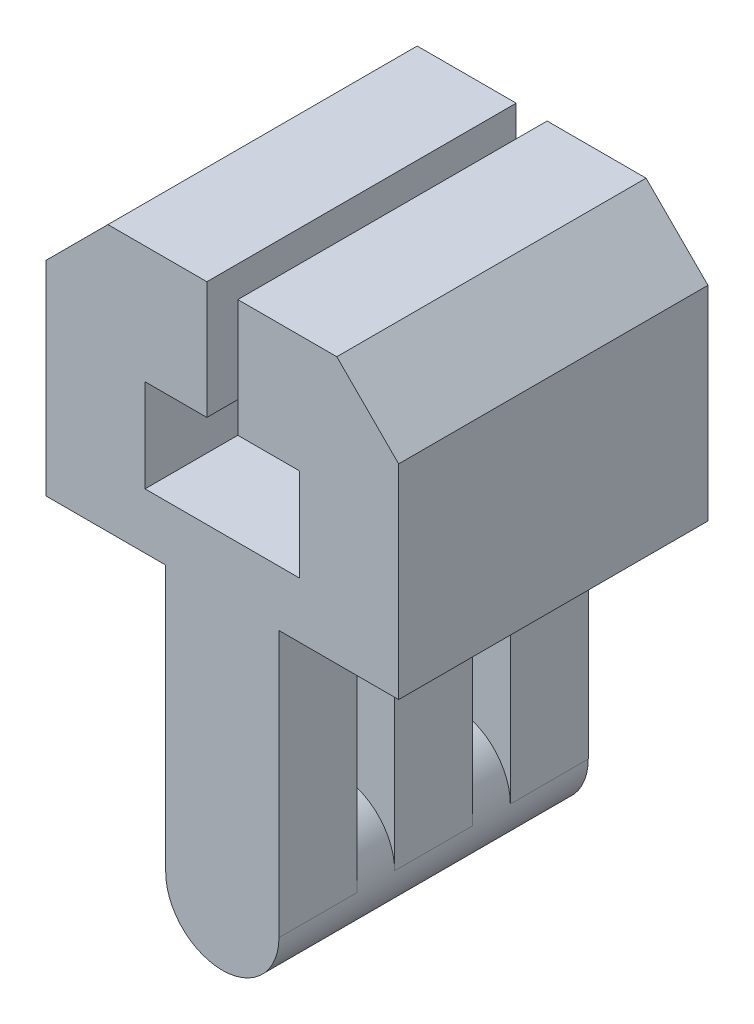
from build123d import *

# Parameters (mm, degrees)
SKETCH1_R                = 23.241
FTA_DEPTH                = 127
SKETCH2_W                = 46.482
SKETCH2_H                = 101.6
FTB_DEPTH                = 32.004
FTC_DEPTH                = 127
SKETCH4_W                = 40.64
SKETCH4_H                = 38.1
FTD1_DEPTH               = 127
SKETCH4_5_W              = 40.64
SKETCH4_5_H              = 38.1
FTD2_DEPTH               = 127
SKETCH5_W                = 25.4
SKETCH5_H                = 48.26
FTE_DEPTH                = 127
FTE_2_DEPTH              = 127
SKETCH6_W                = 40.64
SKETCH6_H                = 48.26
SKETCH6_H_2              = 30.48
FILLER_DEPTH             = 127
BOSS_EXTRUDE1_DEPTH      = 16.002
BOSS_EXTRUDE1_DEPTH_BACK = 16.002
SKETCH8_W                = 46.482
SKETCH8_H                = 101.6
CHAMFER1_SIZE            = 7.62
BOSS_EXTRUDE2_DEPTH      = 32.004
CHAMFER2_SIZE            = 25.4
CHAMFER3_SIZE            = 7.62


with BuildPart() as part:
    # Sketch1 → ftA (new body)
    with BuildSketch(Plane.XY):
        Circle(SKETCH1_R)
    extrude(amount=-FTA_DEPTH)


with BuildPart() as body_2:
    # Sketch2 → ftB (new body)
    with BuildSketch(Plane(origin=(0, 0, -127), x_dir=(-1, 0, 0), z_dir=(0, 0, -1))):
        with Locations((0, 50.8)):
            Rectangle(SKETCH2_W, SKETCH2_H)
    extrude(amount=-FTB_DEPTH)

    # Sketch3 → ftC (add)
    with BuildSketch(Plane(origin=(0, 0, -127), x_dir=(-1, 0, 0), z_dir=(0, 0, -1))):
        Polygon((-23.241, 101.6), (-31.75, 101.6), (-31.75, 132.08), (31.75, 132.08), (31.75, 101.6), (23.241, 101.6), align=None)
    extrude(amount=-FTC_DEPTH)



with BuildPart() as body_3:
    # Sketch4 → ftD1 (new body)
    with BuildSketch(Plane.XY):
        with Locations((52.07, 151.13)):
            Rectangle(SKETCH4_W, SKETCH4_H)
    extrude(amount=-FTD1_DEPTH)

    # Sketch4<5> → ftD2 (add)
    with BuildSketch(Plane.XY):
        with Locations((-52.07, 151.13)):
            Rectangle(SKETCH4_5_W, SKETCH4_5_H)
        with Locations((52.07, 151.13)):
            Rectangle(SKETCH4_5_W, SKETCH4_5_H)
    extrude(amount=-FTD2_DEPTH)


with BuildPart() as ftd2_piece_1:
    # of the separate pieces the step leaves, piece 1, a body of its own (ftd2_pieces)
    add(body_3.part.solids().sort_by_distance((31.75, 132.08, 0))[0])


with BuildPart() as ftd2_piece_2:
    # of the separate pieces the step leaves, piece 2, a body of its own (ftd2_pieces)
    add(body_3.part.solids().sort_by_distance((-31.75, 132.08, 0))[0])


with BuildPart() as body_5:
    # Sketch5 → ftE (new body)
    with BuildSketch(Plane.XY):
        with Locations((-19.05, 194.31)):
            Rectangle(SKETCH5_W, SKETCH5_H)
    extrude(amount=-FTE_DEPTH)


with BuildPart() as body_6:
    # Sketch5 → ftE 2 (new body)
    with BuildSketch(Plane.XY):
        with Locations((19.05, 194.31)):
            Rectangle(SKETCH5_W, SKETCH5_H)
    extrude(amount=-FTE_2_DEPTH)


with BuildPart() as body_2_1:
    add(body_2.part)

    add(ftd2_piece_1.part)  # Filler merges ftD2 piece 1

    add(ftd2_piece_2.part)  # Filler merges ftD2 piece 2

    add(body_5.part)  # Filler merges body 5

    add(body_6.part)  # Filler merges body 6
    # Sketch6 → Filler (add)
    with BuildSketch(Plane.XY):
        with Locations((52.07, 194.31)):
            Rectangle(SKETCH6_W, SKETCH6_H)
        with Locations((-52.07, 194.31)):
            Rectangle(SKETCH6_W, SKETCH6_H)
        with Locations((-52.07, 116.84)):
            Rectangle(SKETCH6_W, SKETCH6_H_2)
        with Locations((52.07, 116.84)):
            Rectangle(SKETCH6_W, SKETCH6_H_2)
    extrude(amount=-FILLER_DEPTH)

    # Combine3: union part
    add(part.part)

    # Sketch8 → Boss-Extrude1 (add, two sides: drawn at the far end of the back side and taken through both)
    with BuildSketch(Plane.XY.offset(-63.5).offset(-BOSS_EXTRUDE1_DEPTH_BACK)):
        with Locations((0, 50.8)):
            Rectangle(SKETCH8_W, SKETCH8_H)
    extrude(amount=BOSS_EXTRUDE1_DEPTH + BOSS_EXTRUDE1_DEPTH_BACK)

    # Chamfer1
    chamfer1_edges = [body_2_1.edges().sort_by_distance(p)[0] for p in [
        (23.241, 101.6, -110.998),
        (0, 101.6, -94.996),
        (-23.241, 101.6, -110.998),
        (-23.241, 101.6, -63.5),
        (0, 101.6, -79.502),
        (23.241, 101.6, -63.5),
        (0, 101.6, -47.498),
        (-72.39, 101.6, -63.5),
        (0, 101.6, 0),
        (72.39, 101.6, -63.5),
    ]]
    chamfer(chamfer1_edges, length=CHAMFER1_SIZE)

    # Sketch9 → Boss-Extrude2 (add)
    with BuildSketch(Plane.XY):
        Polygon((-23.241, 0), (23.241, 0), (23.241, 101.6), (23.241, 109.22), (-23.241, 109.22), (-23.241, 101.6), align=None)
    extrude(amount=-BOSS_EXTRUDE2_DEPTH)

    # Chamfer2
    chamfer2_edges = [body_2_1.edges().sort_by_distance(p)[0] for p in [
        (-72.39, 218.44, -63.5),
        (72.39, 218.44, -63.5),
    ]]
    chamfer(chamfer2_edges, length=CHAMFER2_SIZE)

    # Chamfer3
    chamfer3_edges = [body_2_1.edges().sort_by_distance(p)[0] for p in [
        (-23.241, 101.6, -19.812),
        (23.241, 101.6, -19.812),
        (0, 101.6, -32.004),
    ]]
    chamfer(chamfer3_edges, length=CHAMFER3_SIZE)


solid = body_2_1.part
